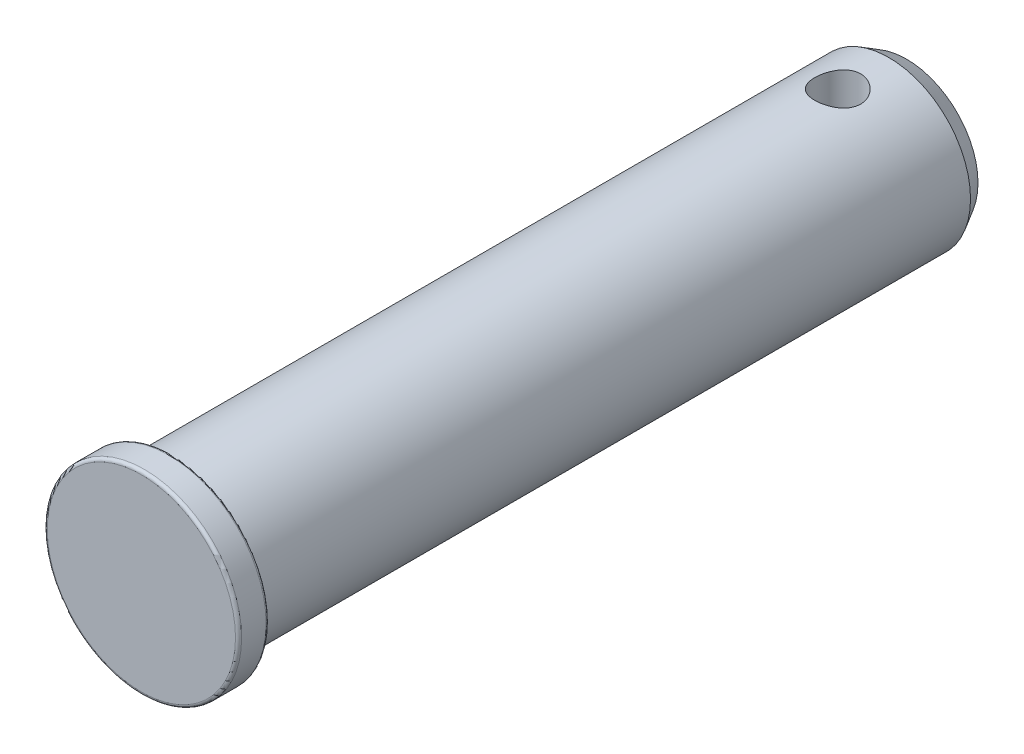
from build123d import *

# Parameters (mm, degrees)
CORTAR_EXTRUIR1_DEPTH      = 77.200073819
CORTAR_EXTRUIR1_DEPTH_BACK = 77.200073819
CROQUIS2_R                 = 2.25
REDONDEO1_R                = 0.3
CHAFL_N1_SIZE              = 1
CHAFL_N1_SIZE2             = 1.732050808
REDONDEO2_R                = 0.3


with BuildPart() as part:
    # Croquis1 → Revolución1 (revolve)
    with BuildSketch(Plane(origin=(0, 0, 0), x_dir=(0, 0, -1), z_dir=(1, 0, 0)), mode=Mode.PRIVATE) as revoluci_n1_sk:
        Polygon((0, 0), (0, 9.525), (3, 9.525), (3, 8), (75, 8), (75, 0), align=None)
    revolve(revoluci_n1_sk.sketch.rotate(Axis((0, 0, 0), (0, 0, -1)), 90), axis=Axis((0, 0, 0), (0, 0, -1)))

    # Croquis2 → Cortar-Extruir1 (cut, two sides: drawn at the far end of the back side and taken through both)
    with BuildSketch(Plane(origin=(0, 0, 0), x_dir=(1, 0, 0), z_dir=(0, 1, 0)).offset(-CORTAR_EXTRUIR1_DEPTH_BACK)):
        with Locations(Location((0, 68.25, 0), (0, 0, 270))):
            Circle(CROQUIS2_R)
    extrude(amount=CORTAR_EXTRUIR1_DEPTH + CORTAR_EXTRUIR1_DEPTH_BACK, mode=Mode.SUBTRACT)

    # Redondeo1
    redondeo1_edges = [part.edges().sort_by_distance(p)[0] for p in [
        (-8, 0, -3),
    ]]
    fillet(redondeo1_edges, radius=REDONDEO1_R)

    # Chaflán1
    chafl_n1_edges = [part.edges().sort_by_distance(p)[0] for p in [
        (-8, 0, -75),
    ]]
    chafl_n1_side = [part.faces().sort_by_distance(p)[0] for p in [
        (0, 0, -75),
    ]]
    chamfer(chafl_n1_edges, length=CHAFL_N1_SIZE, length2=CHAFL_N1_SIZE2, reference=chafl_n1_side[0])

    # Redondeo2
    redondeo2_edges = [part.edges().sort_by_distance(p)[0] for p in [
        (-9.525, 0, -3),
        (-9.525, 0, 0),
    ]]
    fillet(redondeo2_edges, radius=REDONDEO2_R)


solid = part.part
